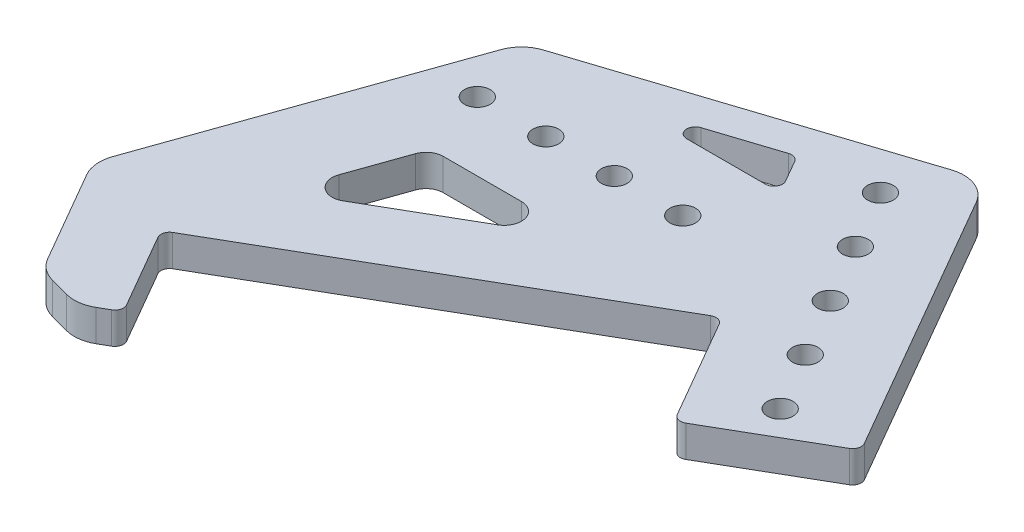
from build123d import *

# Parameters (mm, degrees)
SKETCH1_R           = 2.38125
BOSS_EXTRUDE1_DEPTH = 5.842
FILLET1_R           = 1.5875
FILLET2_R           = 6.35
FILLET3_R           = 1.5875
CUT_EXTRUDE1_DEPTH  = 122.916897323
FILLET4_R           = 3.175


with BuildPart() as part:
    # Sketch1 → Boss-Extrude1 (new body)
    with BuildSketch(Plane(origin=(0, 0, 0), x_dir=(1, 0, 0), z_dir=(0, 1, 0))):
        Polygon((-10.998522628, -6.35), (-23.207348419, 14.79630657), (-89.198484187, -23.30369343), (-82.848484187, -34.302216058), (-79.673484187, -39.801477372), (-85.172745501, -42.976477372), (-93.847006815, -40.652216058), (-106.547006815, -18.655170802), (-85.725, 40.19630657), (-20.751477372, 61.34261314), (10.998522628, 6.35), align=None)
        with Locations(Location((-28.575, 49.493351826, 0), (0, 0, 270))):
            Circle(SKETCH1_R, mode=Mode.SUBTRACT)
        with Locations(Location((-22.225, 38.494829198, 0), (0, 0, 270))):
            Circle(SKETCH1_R, mode=Mode.SUBTRACT)
        with Locations(Location((-15.875, 27.49630657, 0), (0, 0, 270))):
            Circle(SKETCH1_R, mode=Mode.SUBTRACT)
        with Locations(Location((-9.525, 16.497783942, 0), (0, 0, 270))):
            Circle(SKETCH1_R, mode=Mode.SUBTRACT)
        with Locations(Location((-3.175, 5.499261314, 0), (0, 0, 270))):
            Circle(SKETCH1_R, mode=Mode.SUBTRACT)
        with Locations(Location((-43.2397154, 27.49630657, 0), (0, 0, 270))):
            Circle(SKETCH1_R, mode=Mode.SUBTRACT)
        with Locations(Location((-55.9397154, 27.49630657, 0), (0, 0, 270))):
            Circle(SKETCH1_R, mode=Mode.SUBTRACT)
        with Locations(Location((-68.6397154, 27.49630657, 0), (0, 0, 270))):
            Circle(SKETCH1_R, mode=Mode.SUBTRACT)
        with Locations(Location((-81.3397154, 27.49630657, 0), (0, 0, 270))):
            Circle(SKETCH1_R, mode=Mode.SUBTRACT)
        Polygon((-37.872045256, 40.19630657), (-42.195906773, 47.685454402), (-65.206843197, 40.19630657), align=None, mode=Mode.SUBTRACT)
    extrude(amount=BOSS_EXTRUDE1_DEPTH)

    # Fillet1
    fillet1_edges = [part.edges().sort_by_distance(p)[0] for p in [
        (-42.195906773, 2.921, -47.685454402),
        (-65.206843197, 2.921, -40.19630657),
        (-37.872045256, 2.921, -40.19630657),
    ]]
    fillet(fillet1_edges, radius=FILLET1_R)

    # Fillet2
    fillet2_edges = [part.edges().sort_by_distance(p)[0] for p in [
        (-85.725, 2.921, -40.19630657),
        (-20.751477372, 2.921, -61.34261314),
        (-85.172745501, 2.921, 42.976477372),
        (-93.847006815, 2.921, 40.652216058),
        (-106.547006815, 2.921, 18.655170802),
    ]]
    fillet(fillet2_edges, radius=FILLET2_R)

    # Fillet3
    fillet3_edges = [part.edges().sort_by_distance(p)[0] for p in [
        (10.998522628, 2.921, -6.35),
        (-10.998522628, 2.921, 6.35),
        (-23.207348419, 2.921, -14.79630657),
        (-89.198484187, 2.921, 23.30369343),
        (-79.673484187, 2.921, 39.801477372),
    ]]
    fillet(fillet3_edges, radius=FILLET3_R)

    # Sketch2 → Cut-Extrude1 (cut, through all)
    with BuildSketch(Plane(origin=(0, 5.842, 0), x_dir=(1, 0, 0), z_dir=(0, 1, 0))):
        Polygon((-84.549961559, -5.955170802), (-48.607348419, 14.79630657), (-77.207963999, 14.79630657), align=None)
    extrude(amount=-CUT_EXTRUDE1_DEPTH, mode=Mode.SUBTRACT)

    # Fillet4
    fillet4_edges = [part.edges().sort_by_distance(p)[0] for p in [
        (-84.549961559, 2.921, 5.955170802),
        (-77.207963999, 2.921, -14.79630657),
        (-48.607348419, 2.921, -14.79630657),
    ]]
    fillet(fillet4_edges, radius=FILLET4_R)


solid = part.part
